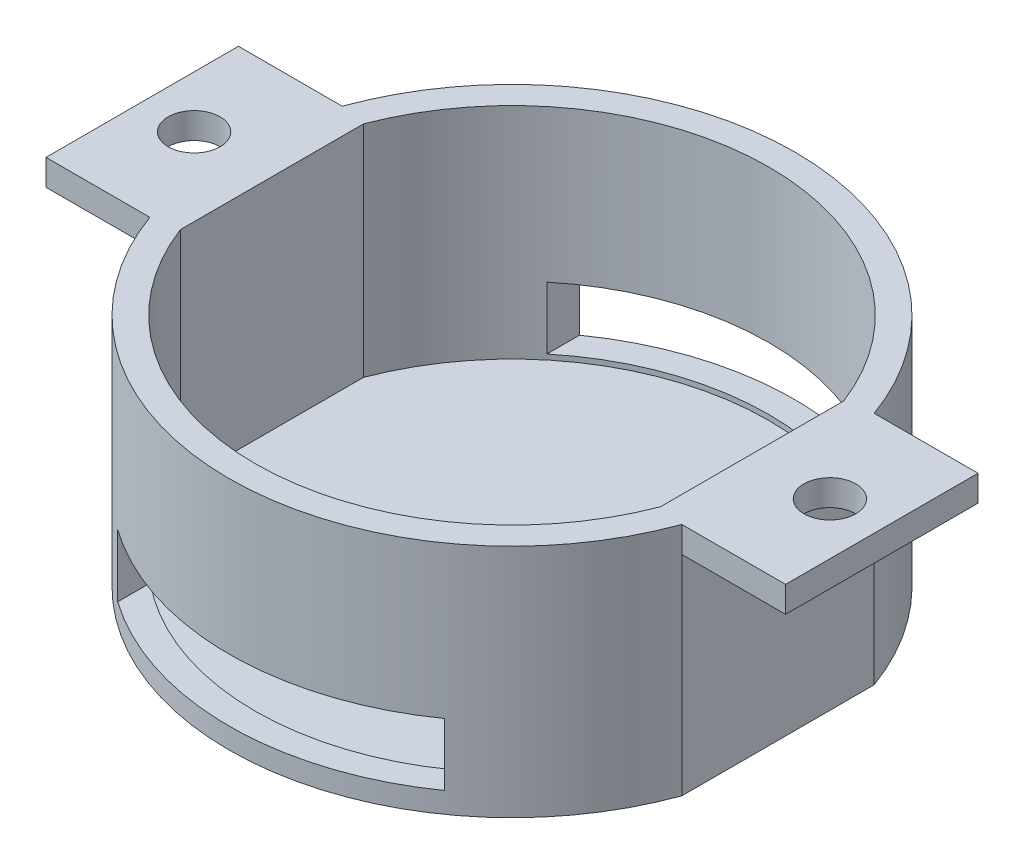
from build123d import *

# Parameters (mm, degrees)
EXTRUDE_1_DEPTH          = 42.3
EXTRUDE_START            = 3
EXTRUDE_2_DEPTH          = 3
SKETCH_3_W               = 37.077621282
SKETCH_3_H               = 5
EXTRUDE_4_DEPTH          = 20
SKETCH_5_W               = 37.077621282
SKETCH_5_H               = 5
EXTRUDE_5_DEPTH          = 20
CUT_EXTRUDE_1_REACH      = 102.493
SKETCH_6_R               = 5
CUT_EXTRUDE_2_REACH      = 102.493
SKETCH_7_R               = 5
CUT_EXTRUDE_3_DEPTH      = 137.919145849
CUT_EXTRUDE_3_DEPTH_BACK = 137.919145849
SKETCH_9_W               = 62.954996742
SKETCH_9_H               = 12


with BuildPart() as part:
    # 草图1 → 凸台-拉伸1 (new body)
    with BuildSketch(Plane(origin=(0, 0, 0), x_dir=(1, 0, 0), z_dir=(0, 1, 0))):
        with BuildLine():
            Line((-51.25, 18.538810641), (-51.25, -18.538810641))
            ThreePointArc((-51.25, -18.538810641), (0, -54.5), (51.25, -18.538810641))
            Line((51.25, -18.538810641), (51.25, 18.538810641))
            ThreePointArc((51.25, 18.538810641), (0, 54.5), (-51.25, 18.538810641))
        make_face()
        with BuildLine():
            Line((-46.25, 17.640507362), (-46.25, -17.640507362))
            ThreePointArc((-46.25, -17.640507362), (0, -49.5), (46.25, -17.640507362))
            Line((46.25, -17.640507362), (46.25, 17.640507362))
            ThreePointArc((46.25, 17.640507362), (0, 49.5), (-46.25, 17.640507362))
        make_face(mode=Mode.SUBTRACT)
    extrude(amount=EXTRUDE_1_DEPTH)

    # 草图2 → 凸台-拉伸2 (add)
    with BuildSketch(Plane(origin=(0, 0, 0), x_dir=(-1, 0, 0), z_dir=(0, -1, 0)).offset(EXTRUDE_START)):
        with BuildLine():
            Line((51.25, -18.538810641), (51.25, 18.538810641))
            ThreePointArc((51.25, 18.538810641), (0, 54.5), (-51.25, 18.538810641))
            Line((-51.25, 18.538810641), (-51.25, -18.538810641))
            ThreePointArc((-51.25, -18.538810641), (0, -54.5), (51.25, -18.538810641))
        make_face()
    extrude(amount=-EXTRUDE_2_DEPTH)

    # 草图3 → 凸台-拉伸4 (add)
    with BuildSketch(Plane.ZY.offset(51.25)):
        with Locations((0, 39.8)):
            Rectangle(SKETCH_3_W, SKETCH_3_H)
    extrude(amount=EXTRUDE_4_DEPTH)

    # 草图5 → 凸台-拉伸5 (add)
    with BuildSketch(Plane(origin=(51.25, 0, 0), x_dir=(0, 0, -1), z_dir=(1, 0, 0))):
        with Locations((0, 39.8)):
            Rectangle(SKETCH_5_W, SKETCH_5_H)
    extrude(amount=EXTRUDE_5_DEPTH)

    # 草图6 → 切除-拉伸1 (cut, up to next)
    with BuildSketch(Plane(origin=(0, 42.3, 0), x_dir=(1, 0, 0), z_dir=(0, 1, 0)), mode=Mode.PRIVATE) as cut_extrude_1_sk1:
        with Locations((-61.25, 0)):
            Circle(SKETCH_6_R)
    cut_extrude_1_tool1 = extrude(cut_extrude_1_sk1.sketch, amount=-CUT_EXTRUDE_1_REACH, mode=Mode.PRIVATE) & part.part
    add(cut_extrude_1_tool1.solids().sort_by_distance((-61.25, 42.3, 0))[0], mode=Mode.SUBTRACT)

    # 草图7 → 切除-拉伸2 (cut, up to next)
    with BuildSketch(Plane(origin=(0, 42.3, 0), x_dir=(1, 0, 0), z_dir=(0, 1, 0)), mode=Mode.PRIVATE) as cut_extrude_2_sk1:
        with Locations((61.25, 0)):
            Circle(SKETCH_7_R)
    cut_extrude_2_tool1 = extrude(cut_extrude_2_sk1.sketch, amount=-CUT_EXTRUDE_2_REACH, mode=Mode.PRIVATE) & part.part
    add(cut_extrude_2_tool1.solids().sort_by_distance((61.25, 42.3, 0))[0], mode=Mode.SUBTRACT)

    # 草图9 → 切除-拉伸3 (cut, two sides: drawn at the far end of the back side and taken through both)
    with BuildSketch(Plane(origin=(0, 0, -54.5), x_dir=(-1, 0, 0), z_dir=(0, 0, -1)).offset(-CUT_EXTRUDE_3_DEPTH_BACK)):
        with Locations((0, 7)):
            Rectangle(SKETCH_9_W, SKETCH_9_H)
    extrude(amount=CUT_EXTRUDE_3_DEPTH + CUT_EXTRUDE_3_DEPTH_BACK, mode=Mode.SUBTRACT)


solid = part.part
